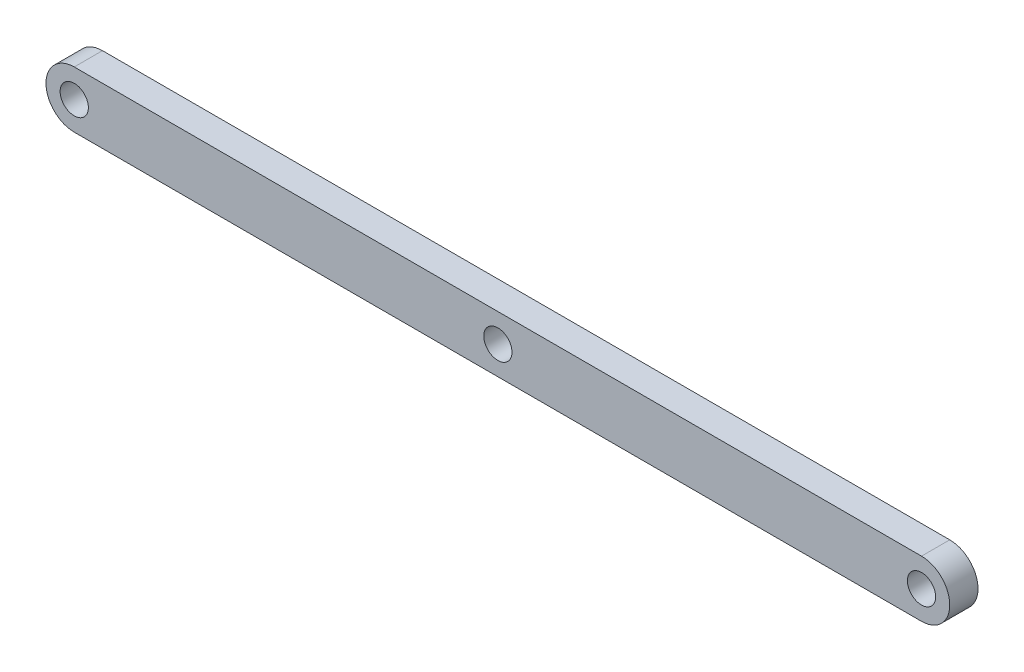
from build123d import *

# Parameters (mm, degrees)
SKETCH1_R           = 5
BOSS_EXTRUDE1_DEPTH = 10


with BuildPart() as part:
    # Sketch1 → Boss-Extrude1 (new body)
    with BuildSketch(Plane.XY):
        with BuildLine():
            Line((0, 10), (300, 10))
            ThreePointArc((300, 10), (310, 0), (300, -10))
            Line((300, -10), (0, -10))
            ThreePointArc((0, -10), (-10, 0), (0, 10))
        make_face()
        Circle(SKETCH1_R, mode=Mode.SUBTRACT)
        with Locations((300, 0)):
            Circle(SKETCH1_R, mode=Mode.SUBTRACT)
        with Locations((150, 0)):
            Circle(SKETCH1_R, mode=Mode.SUBTRACT)
    extrude(amount=BOSS_EXTRUDE1_DEPTH)


solid = part.part
